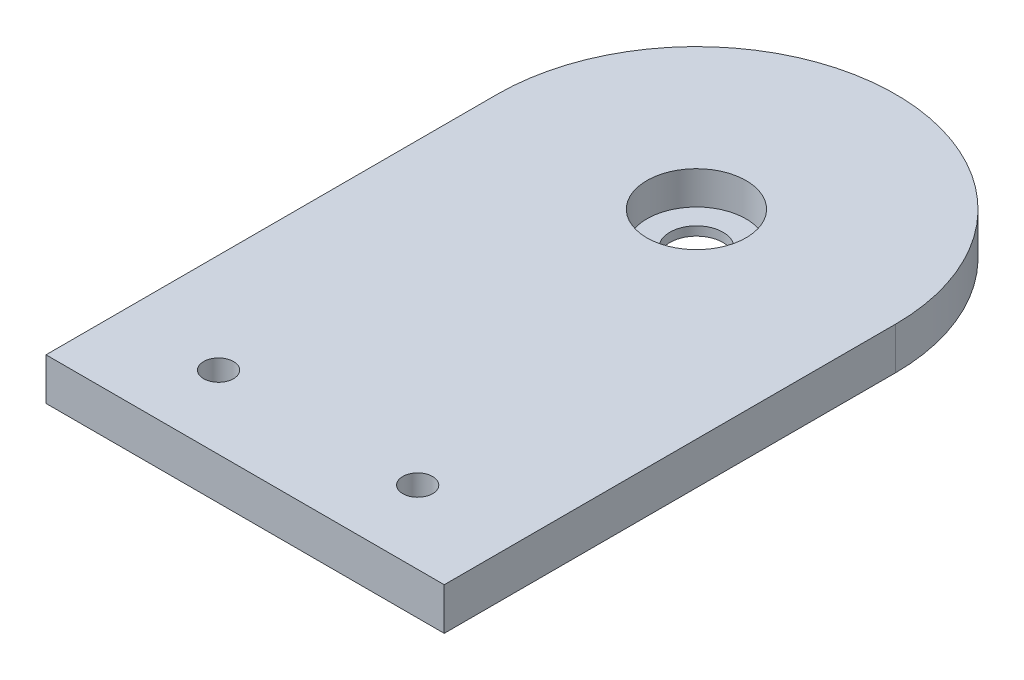
from build123d import *

# Parameters (mm, degrees)
PLACA_START              = -66.1
SK_PLACA_W               = 60
SK_PLACA_H               = 49
PLACA_DEPTH              = 6.35
EXTREMO_START            = -66.1
SK_EXTREMO_R             = 30
EXTREMO_DEPTH            = 6.35
ALOJAMIENTO_696ZZ_START  = -64.75
SK_ALOJAMIENTO_696ZZ_R   = 7.475
ALOJAMIENTO_696ZZ_DEPTH  = 5
PASO_EXTRACTOR_START     = -66.1
SK_PASO_EXTRACTOR_R      = 4
PASO_EXTRACTOR_DEPTH     = 1.35
EXTENSION_PESTANAS_START = -66.1
SK_EXTENSION_PESTANAS_W  = 60
SK_EXTENSION_PESTANAS_H  = 19
EXTENSION_PESTANAS_DEPTH = 6.35
PASANTES_M4_REPISA_START = -66.1
SK_PASANTES_M4_REPISA_R  = 2.25
PASANTES_M4_REPISA_DEPTH = 6.35


with BuildPart() as part:
    # Sk_Placa → Placa (new body)
    with BuildSketch(Plane(origin=(0, 0, 0), x_dir=(1, 0, 0), z_dir=(0, 1, 0)).offset(PLACA_START)):
        with Locations((0, -354.5)):
            Rectangle(SK_PLACA_W, SK_PLACA_H)
    extrude(amount=PLACA_DEPTH)

    # Sk_Extremo → Extremo (add)
    with BuildSketch(Plane(origin=(0, 0, 0), x_dir=(1, 0, 0), z_dir=(0, 1, 0)).offset(EXTREMO_START)):
        with Locations((0, -330)):
            Circle(SK_EXTREMO_R)
    extrude(amount=EXTREMO_DEPTH)

    # Sk_Alojamiento_696ZZ → Alojamiento_696ZZ (cut)
    with BuildSketch(Plane(origin=(0, 0, 0), x_dir=(1, 0, 0), z_dir=(0, 1, 0)).offset(ALOJAMIENTO_696ZZ_START)):
        with Locations(Location((0, -330, 0), (0, 0, 270))):
            Circle(SK_ALOJAMIENTO_696ZZ_R)
    extrude(amount=ALOJAMIENTO_696ZZ_DEPTH, mode=Mode.SUBTRACT)

    # Sk_Paso_extractor → Paso_extractor (cut)
    with BuildSketch(Plane(origin=(0, 0, 0), x_dir=(1, 0, 0), z_dir=(0, 1, 0)).offset(PASO_EXTRACTOR_START)):
        with Locations(Location((0, -330, 0), (0, 0, 90))):
            Circle(SK_PASO_EXTRACTOR_R)
    extrude(amount=PASO_EXTRACTOR_DEPTH, mode=Mode.SUBTRACT)

    # Sk_Extension_pestanas → Extension_pestanas (add)
    with BuildSketch(Plane(origin=(0, 0, 0), x_dir=(1, 0, 0), z_dir=(0, 1, 0)).offset(EXTENSION_PESTANAS_START)):
        with Locations((0, -388.5)):
            Rectangle(SK_EXTENSION_PESTANAS_W, SK_EXTENSION_PESTANAS_H)
    extrude(amount=EXTENSION_PESTANAS_DEPTH)

    # Sk_Pasantes_M4_repisa → Pasantes_M4_repisa (cut)
    with BuildSketch(Plane(origin=(0, 0, 0), x_dir=(1, 0, 0), z_dir=(0, 1, 0)).offset(PASANTES_M4_REPISA_START)):
        with Locations(Location((-15, -387, 0), (0, 0, 270))):
            Circle(SK_PASANTES_M4_REPISA_R)
        with Locations(Location((15, -387, 0), (0, 0, 270))):
            Circle(SK_PASANTES_M4_REPISA_R)
    extrude(amount=PASANTES_M4_REPISA_DEPTH, mode=Mode.SUBTRACT)


solid = part.part
